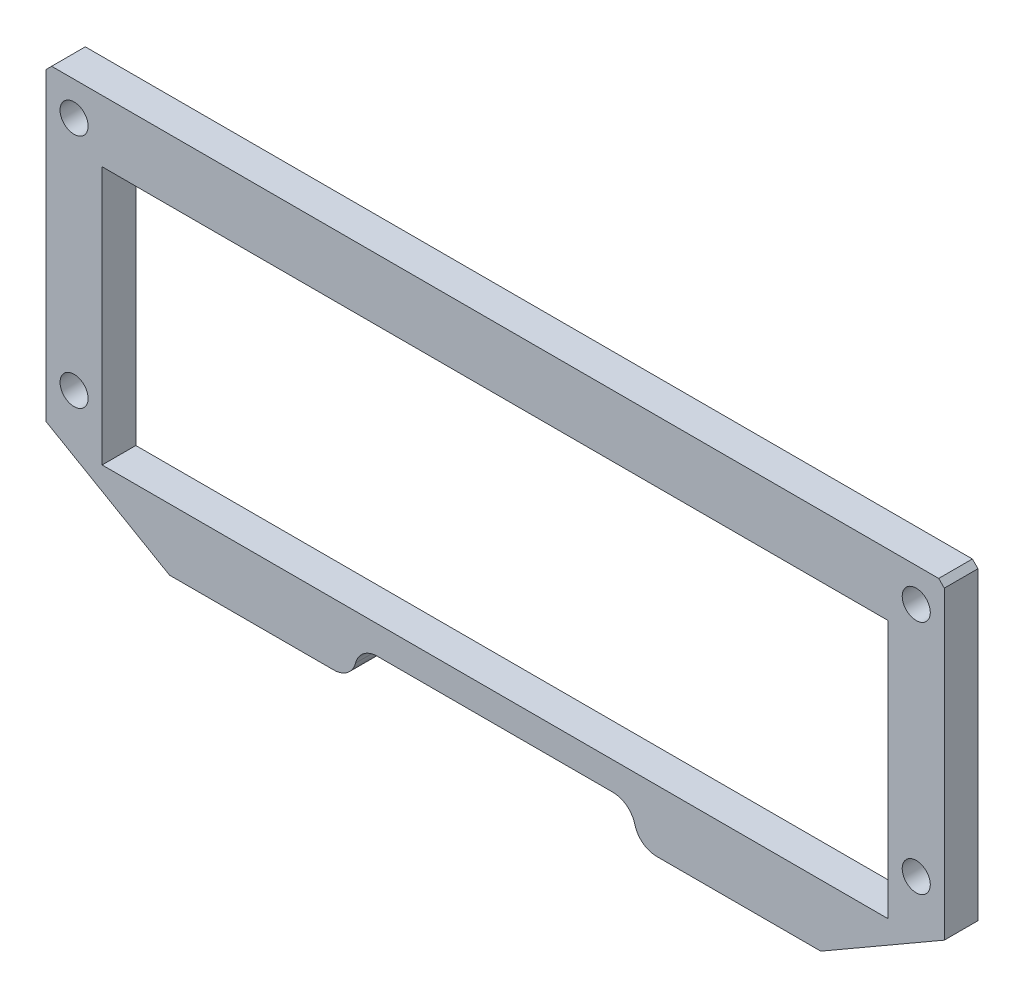
from build123d import *

# Parameters (mm, degrees)
SKETCH_1_W              = 80
SKETCH_1_H              = 34
EXTRUDE_1_DEPTH         = 3
SKETCH_2_W              = 70
SKETCH_2_H              = 23
CUT_EXTRUDE_2_DEPTH     = 3
CHAMFER_1_SIZE          = 0.5
SKETCH_7_W              = 25
SKETCH_7_H              = 3
CUT_EXTRUDE_6_DEPTH     = 3
FILLET_2_R              = 2
CHAMFER_2_SIZE          = 11
CHAMFER_2_SIZE2         = 6.350852961
CHAMFER_3_SIZE          = 11
CHAMFER_3_SIZE2         = 6.350852961
FILLET_3_R              = 2
HOLE_WIZARD_2_5_2_5_1_D = 2.5


with BuildPart() as part:
    # 草图1 → Extrude 1 (new body)
    with BuildSketch(Plane.XY):
        Rectangle(SKETCH_1_W, SKETCH_1_H)
    extrude(amount=EXTRUDE_1_DEPTH)

    # 草图2 → 拉伸2 (cut)
    with BuildSketch(Plane.XY.offset(3)):
        Rectangle(SKETCH_2_W, SKETCH_2_H)
    extrude(amount=-CUT_EXTRUDE_2_DEPTH, mode=Mode.SUBTRACT)

    # 倒角1
    chamfer_1_edges = [part.edges().sort_by_distance(p)[0] for p in [
        (-40, 17, 1.5),
        (40, 17, 1.5),
    ]]
    chamfer(chamfer_1_edges, length=CHAMFER_1_SIZE)

    # 草图7 → 拉伸6 (cut)
    with BuildSketch(Plane.XY.offset(3)):
        with Locations((0, -15.5)):
            Rectangle(SKETCH_7_W, SKETCH_7_H)
    extrude(amount=-CUT_EXTRUDE_6_DEPTH, mode=Mode.SUBTRACT)

    # 圆角2
    fillet_2_edges = [part.edges().sort_by_distance(p)[0] for p in [
        (-12.5, -14, 1.5),
        (12.5, -14, 1.5),
    ]]
    fillet(fillet_2_edges, radius=FILLET_2_R)

    # 倒角2
    chamfer_2_edges = [part.edges().sort_by_distance(p)[0] for p in [
        (40, -17, 1.5),
    ]]
    chamfer_2_side = [part.faces().sort_by_distance(p)[0] for p in [
        (26.25, -17, 1.5),
    ]]
    chamfer(chamfer_2_edges, length=CHAMFER_2_SIZE, length2=CHAMFER_2_SIZE2, reference=chamfer_2_side[0])

    # 倒角3
    chamfer_3_edges = [part.edges().sort_by_distance(p)[0] for p in [
        (-40, -17, 1.5),
    ]]
    chamfer_3_side = [part.faces().sort_by_distance(p)[0] for p in [
        (-26.25, -17, 1.5),
    ]]
    chamfer(chamfer_3_edges, length=CHAMFER_3_SIZE, length2=CHAMFER_3_SIZE2, reference=chamfer_3_side[0])

    # 圆角3
    fillet_3_edges = [part.edges().sort_by_distance(p)[0] for p in [
        (12.5, -17, 1.5),
        (-12.5, -17, 1.5),
    ]]
    fillet(fillet_3_edges, radius=FILLET_3_R)

    # Ø2.5 (2.5) 直径孔1 (through all)
    with Locations(Plane(origin=(-37.5, -7, 0), x_dir=(-1, 0, 0), z_dir=(0, 0, -1))):
        with Locations((0, 0), (0, 21), (-75, 21), (-75, 0)):
            Hole(HOLE_WIZARD_2_5_2_5_1_D / 2)


solid = part.part
